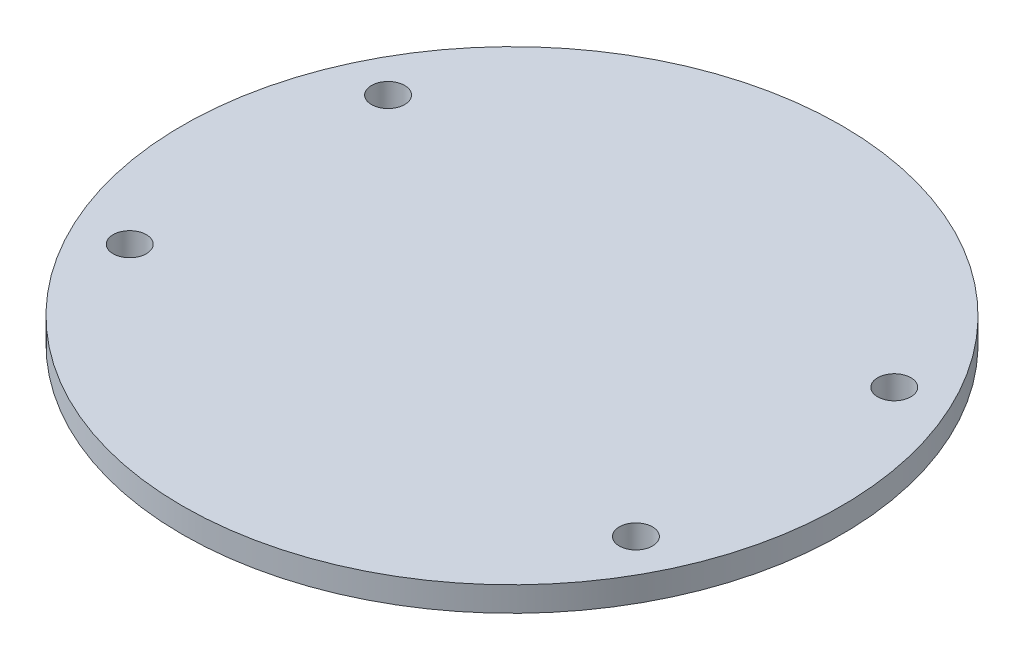
from build123d import *

# Parameters (mm, degrees)
SKETCH1_R           = 31.75
SKETCH1_R_2         = 1.6
BOSS_EXTRUDE1_DEPTH = 2.38125


with BuildPart() as part:
    # Sketch1 → Boss-Extrude1 (new body)
    with BuildSketch(Plane(origin=(0, 0, 0), x_dir=(1, 0, 0), z_dir=(0, 1, 0))):
        with Locations(Location((0, 0, 0), (0, 0, 90))):
            Circle(SKETCH1_R)
        with Locations(Location((24.384, 12.446, 0), (0, 0, 90))):
            Circle(SKETCH1_R_2, mode=Mode.SUBTRACT)
        with Locations(Location((24.384, -12.446, 0), (0, 0, 90))):
            Circle(SKETCH1_R_2, mode=Mode.SUBTRACT)
        with Locations(Location((-24.384, 12.446, 0), (0, 0, 90))):
            Circle(SKETCH1_R_2, mode=Mode.SUBTRACT)
        with Locations(Location((-24.384, -12.446, 0), (0, 0, 90))):
            Circle(SKETCH1_R_2, mode=Mode.SUBTRACT)
    extrude(amount=BOSS_EXTRUDE1_DEPTH)


solid = part.part
